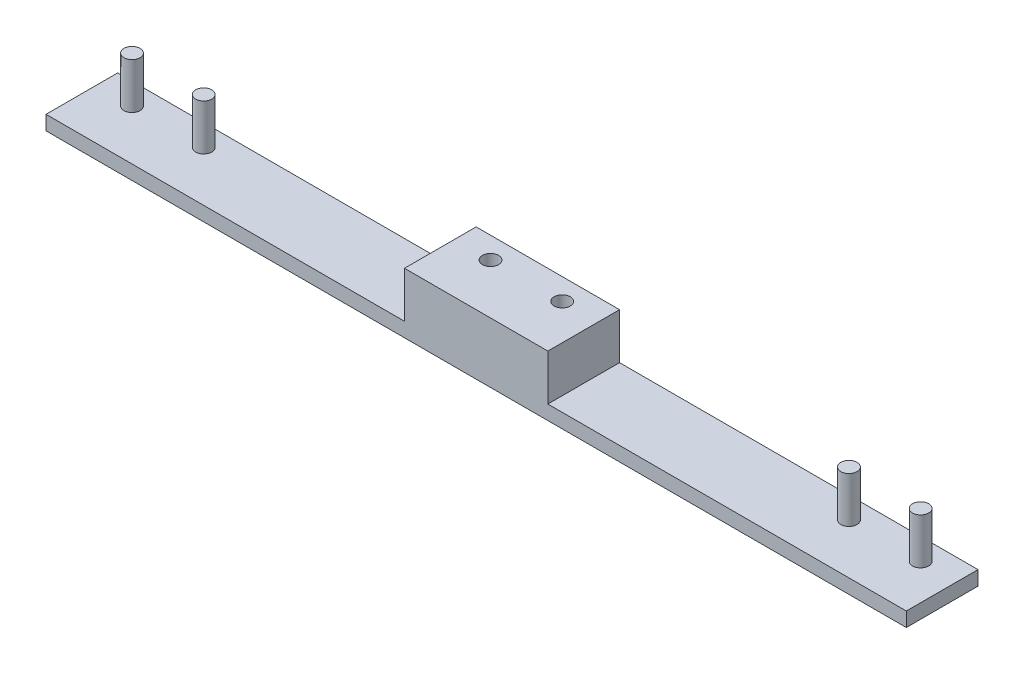
from build123d import *

# Parameters (mm, degrees)
SKETCH2_W           = 40
SKETCH2_H           = 10
BOSS_EXTRUDE1_DEPTH = 2
SKETCH2_3_W         = 20
SKETCH2_3_H         = 10
BOSS_EXTRUDE2_DEPTH = 2
SKETCH2_4_R         = 1.125
BOSS_EXTRUDE3_DEPTH = 6.4
SKETCH4_W           = 10
SKETCH4_H           = 10
SKETCH4_R           = 1.125
BOSS_EXTRUDE4_DEPTH = 6.4
SKETCH4_2_R         = 1.125
CUT_EXTRUDE2_DEPTH  = 62.163387741


with BuildPart() as part:
    # Sketch2 → Boss-Extrude1 (new body)
    with BuildSketch(Plane(origin=(0, 0, 0), x_dir=(1, 0, 0), z_dir=(0, 1, 0))):
        with Locations((40, -5)):
            Rectangle(SKETCH2_W, SKETCH2_H)
    boss_extrude1 = extrude(amount=-BOSS_EXTRUDE1_DEPTH)

    # Sketch2<3> → Boss-Extrude2 (add)
    with BuildSketch(Plane(origin=(0, 0, 0), x_dir=(1, 0, 0), z_dir=(0, 1, 0))):
        with Locations((10, -5)):
            Rectangle(SKETCH2_3_W, SKETCH2_3_H)
    boss_extrude2 = extrude(amount=-BOSS_EXTRUDE2_DEPTH)

    # Sketch2<4> → Boss-Extrude3 (add)
    with BuildSketch(Plane(origin=(0, 0, 0), x_dir=(1, 0, 0), z_dir=(0, 1, 0))):
        with Locations((5, -3)):
            Circle(SKETCH2_4_R)
        with Locations((15, -3)):
            Circle(SKETCH2_4_R)
    boss_extrude3 = extrude(amount=BOSS_EXTRUDE3_DEPTH)

    # Sketch4 → Boss-Extrude4 (add)
    with BuildSketch(Plane(origin=(0, 0, 0), x_dir=(1, 0, 0), z_dir=(0, 1, 0))):
        with Locations((55, -5)):
            Rectangle(SKETCH4_W, SKETCH4_H)
        with Locations((55, -3)):
            Circle(SKETCH4_R, mode=Mode.SUBTRACT)
    boss_extrude4 = extrude(amount=BOSS_EXTRUDE4_DEPTH)

    # Sketch4<2> → Cut-Extrude2 (cut, through all)
    with BuildSketch(Plane(origin=(0, 0, 0), x_dir=(1, 0, 0), z_dir=(0, 1, 0))):
        with Locations((55, -3)):
            Circle(SKETCH4_2_R)
    cut_extrude2 = extrude(amount=-CUT_EXTRUDE2_DEPTH, mode=Mode.SUBTRACT)

    # Mirror2: Boss-Extrude1, Boss-Extrude2, Boss-Extrude3, Boss-Extrude4, Cut-Extrude2 across plane
    add(boss_extrude1.mirror(Plane(origin=(60, -2, 0), x_dir=(0, 0, 1), z_dir=(-1, 0, 0))))
    add(boss_extrude2.mirror(Plane(origin=(60, -2, 0), x_dir=(0, 0, 1), z_dir=(-1, 0, 0))))
    add(boss_extrude3.mirror(Plane(origin=(60, -2, 0), x_dir=(0, 0, 1), z_dir=(-1, 0, 0))))
    add(boss_extrude4.mirror(Plane(origin=(60, -2, 0), x_dir=(0, 0, 1), z_dir=(-1, 0, 0))))
    add(cut_extrude2.mirror(Plane(origin=(60, -2, 0), x_dir=(0, 0, 1), z_dir=(-1, 0, 0))), mode=Mode.SUBTRACT)


solid = part.part
